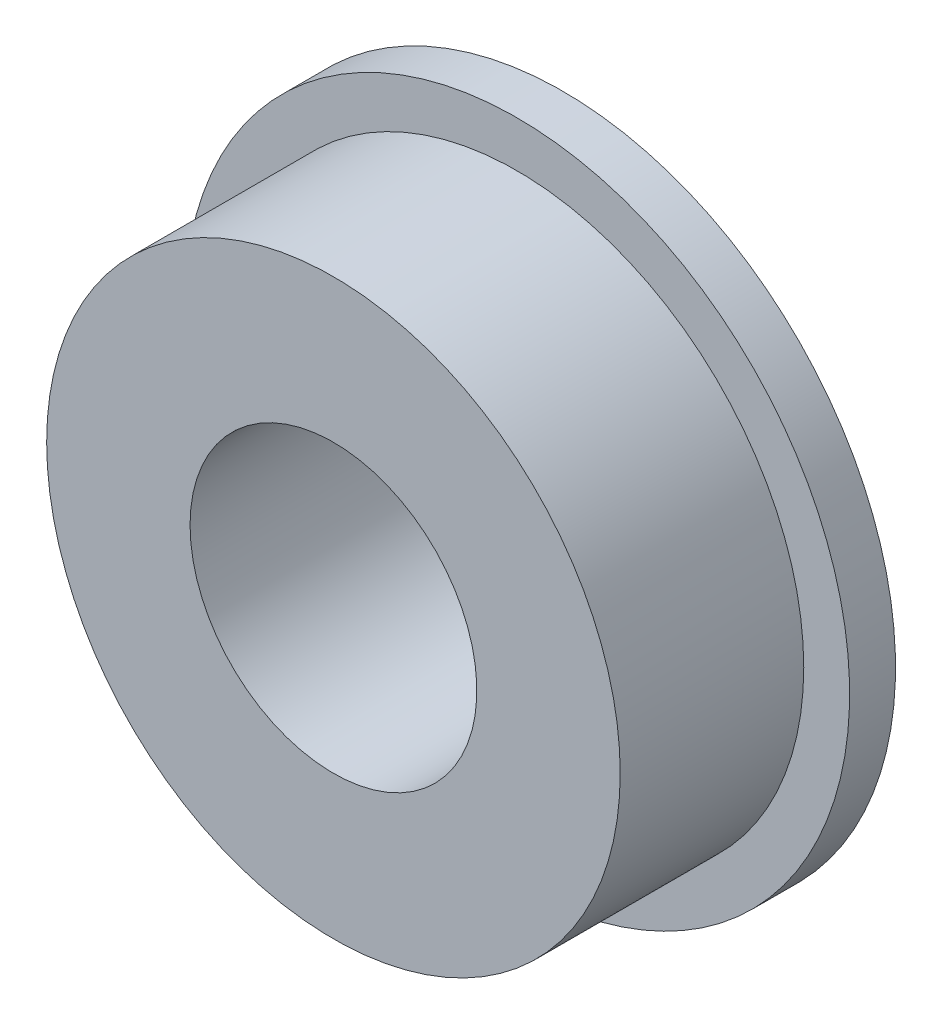
from build123d import *

# Parameters (mm, degrees)
SKETCH_1_R          = 5
EXTRUDE_1_DEPTH     = 4
SKETCH_2_R          = 5.8
EXTRUDE_2_DEPTH     = 0.8
SKETCH_3_R          = 2.5
CUT_EXTRUDE_1_DEPTH = 10.125787637


with BuildPart() as part:
    # 草图1 → 凸台-拉伸1 (new body)
    with BuildSketch(Plane.XY):
        Circle(SKETCH_1_R)
    extrude(amount=EXTRUDE_1_DEPTH)

    # 草图2 → 凸台-拉伸2 (add)
    with BuildSketch(Plane(origin=(0, 0, 0), x_dir=(-1, 0, 0), z_dir=(0, 0, -1))):
        Circle(SKETCH_2_R)
    extrude(amount=-EXTRUDE_2_DEPTH)

    # 草图3 → 切除-拉伸1 (cut, through all)
    with BuildSketch(Plane(origin=(0, 0, 0), x_dir=(-1, 0, 0), z_dir=(0, 0, -1))):
        Circle(SKETCH_3_R)
    extrude(amount=-CUT_EXTRUDE_1_DEPTH, mode=Mode.SUBTRACT)


solid = part.part
